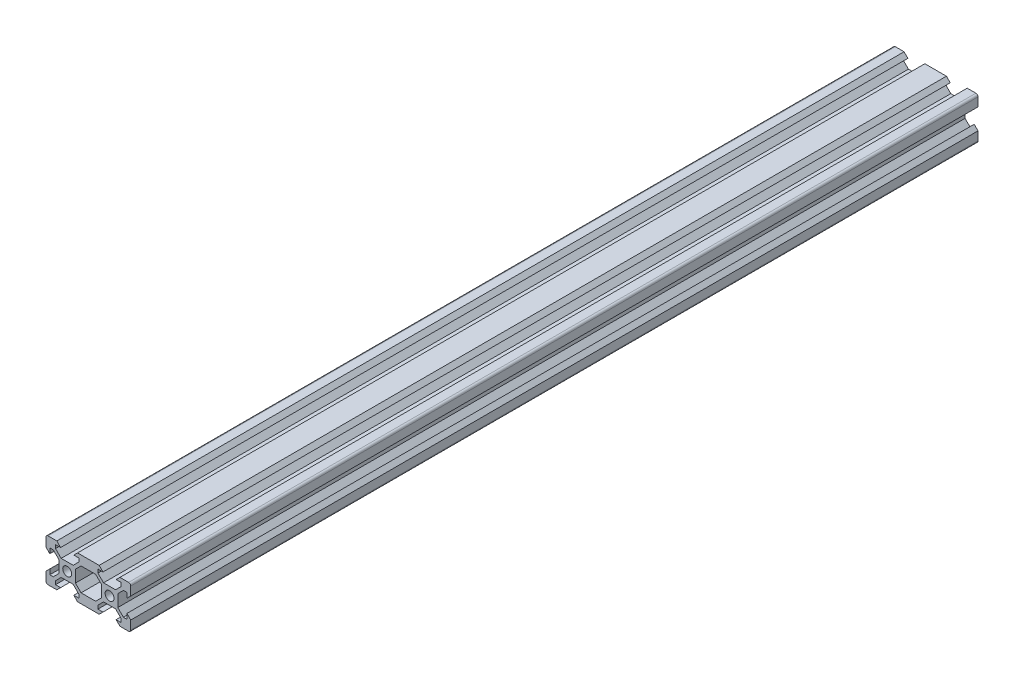
from build123d import *

# Parameters (mm, degrees)
SKETCH2_W            = 20
SKETCH2_H            = 20
BOSS_EXTRUDE1_DEPTH  = 400
CUT_EXTRUDE1_DEPTH   = 401.249921924
CIRPATTERN2_COUNT    = 4
SKETCH9_R            = 2.1
CUT_EXTRUDE2_DEPTH   = 401.249921924
MIRROR1_COPY_1_DEPTH = 401.249921924
MIRROR1_COPY_2_DEPTH = 401.249921924
MIRROR1_COPY_3_DEPTH = 401.249921924
CUT_EXTRUDE3_DEPTH   = 402.248052955
FILLET1_R            = 1


with BuildPart() as part:
    # Sketch2 → Boss-Extrude1 (new body)
    with BuildSketch(Plane.XY):
        Rectangle(SKETCH2_W, SKETCH2_H)
    boss_extrude1 = extrude(amount=-BOSS_EXTRUDE1_DEPTH)

    # Sketch3 → Cut-Extrude1 (cut, symmetric)
    with BuildSketch(Plane.XY):
        Polygon((-3.1, 8.2), (-4.9, 10), (4.9, 10), (3.1, 8.2), (5.5, 8.2), (5.5, 6.56), (2.84, 3.9), (-2.84, 3.9), (-5.5, 6.56), (-5.5, 8.2), align=None)
    cut_extrude1 = extrude(amount=CUT_EXTRUDE1_DEPTH, both=True, mode=Mode.SUBTRACT)

    # CirPattern2: Cut-Extrude1 ×4 about axis
    cirpattern2_axis = Axis((0, 0, 0), (0, 0, 1))
    for i in range(1, CIRPATTERN2_COUNT):
        add(cut_extrude1.rotate(cirpattern2_axis, i * 360 / CIRPATTERN2_COUNT), mode=Mode.SUBTRACT)

    # Sketch9 → Cut-Extrude2 (cut, through all)
    with BuildSketch(Plane.XY):
        Circle(SKETCH9_R)
    cut_extrude2 = extrude(amount=-CUT_EXTRUDE2_DEPTH, mode=Mode.SUBTRACT)

    # Mirror1: Boss-Extrude1, Cut-Extrude1, Cut-Extrude2 across plane
    add(boss_extrude1.mirror(Plane(origin=(10, 10, -400), x_dir=(0, 0, 1), z_dir=(1, 0, 0))))
    add(cut_extrude1.mirror(Plane(origin=(10, 10, -400), x_dir=(0, 0, 1), z_dir=(1, 0, 0))), mode=Mode.SUBTRACT)
    add(cut_extrude2.mirror(Plane(origin=(10, 10, -400), x_dir=(0, 0, 1), z_dir=(1, 0, 0))), mode=Mode.SUBTRACT)

    # Mirror1 copy 1 sketch → Mirror1 copy 1 (cut, symmetric)
    with BuildSketch(Plane(origin=(20, 0, 0), x_dir=(0, 1, 0), z_dir=(0, 0, 1))):
        Polygon((-3.1, -8.2), (-4.9, -10), (4.9, -10), (3.1, -8.2), (5.5, -8.2), (5.5, -6.56), (2.84, -3.9), (-2.84, -3.9), (-5.5, -6.56), (-5.5, -8.2), align=None)
    extrude(amount=MIRROR1_COPY_1_DEPTH, both=True, mode=Mode.SUBTRACT)

    # Mirror1 copy 2 sketch → Mirror1 copy 2 (cut, symmetric)
    with BuildSketch(Plane(origin=(20, 0, 0), x_dir=(1, 0, 0), z_dir=(0, 0, 1))):
        Polygon((-3.1, -8.2), (-4.9, -10), (4.9, -10), (3.1, -8.2), (5.5, -8.2), (5.5, -6.56), (2.84, -3.9), (-2.84, -3.9), (-5.5, -6.56), (-5.5, -8.2), align=None)
    extrude(amount=MIRROR1_COPY_2_DEPTH, both=True, mode=Mode.SUBTRACT)

    # Mirror1 copy 3 sketch → Mirror1 copy 3 (cut, symmetric)
    with BuildSketch(Plane(origin=(20, 0, 0), x_dir=(0, -1, 0), z_dir=(0, 0, 1))):
        Polygon((-3.1, -8.2), (-4.9, -10), (4.9, -10), (3.1, -8.2), (5.5, -8.2), (5.5, -6.56), (2.84, -3.9), (-2.84, -3.9), (-5.5, -6.56), (-5.5, -8.2), align=None)
    extrude(amount=MIRROR1_COPY_3_DEPTH, both=True, mode=Mode.SUBTRACT)

    # Sketch10 → Cut-Extrude3 (cut, through all)
    with BuildSketch(Plane.XY):
        Polygon((13.44, -5.5), (11.8, -5.5), (8.2, -5.5), (6.56, -5.5), (6.56, 5.5), (8.2, 5.5), (11.8, 5.5), (13.44, 5.5), align=None)
    extrude(amount=-CUT_EXTRUDE3_DEPTH, mode=Mode.SUBTRACT)

    # Fillet1
    fillet1_edges = [part.edges().sort_by_distance(p)[0] for p in [
        (30, 10, -200),
        (30, -10, -200),
        (-10, 10, -200),
        (-10, -10, -200),
    ]]
    fillet(fillet1_edges, radius=FILLET1_R)


solid = part.part
